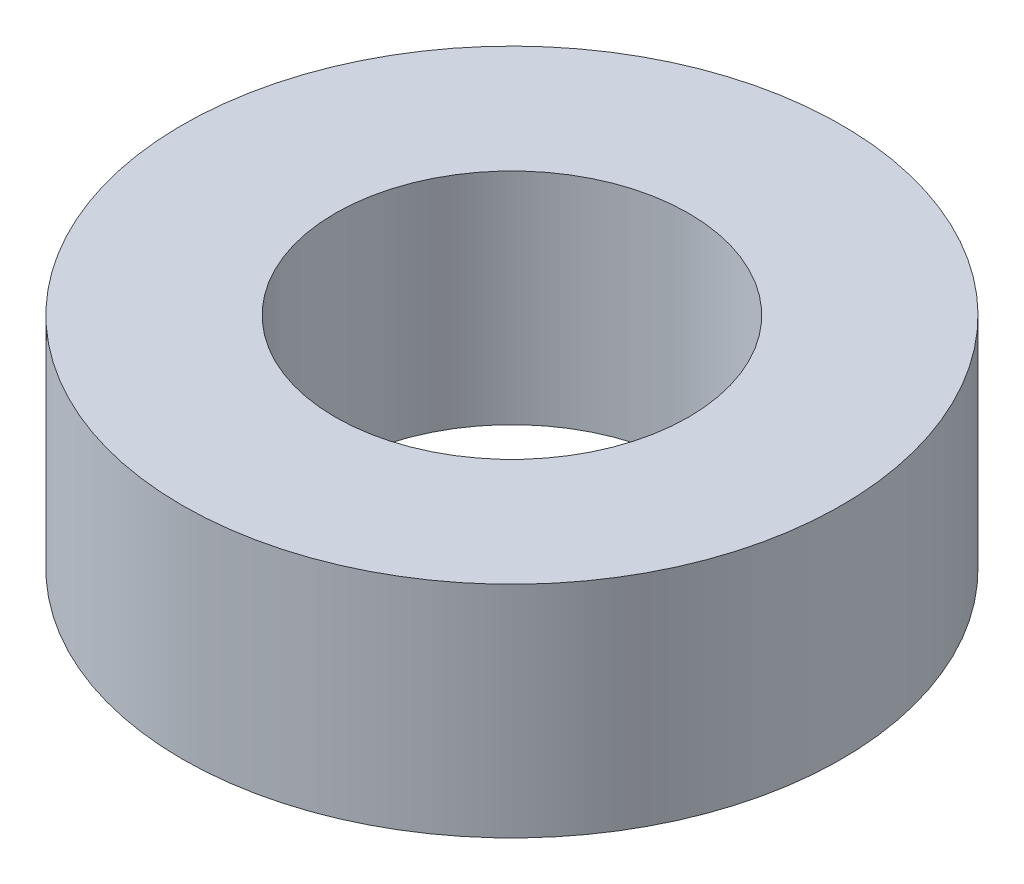
from build123d import *

# Parameters (mm, degrees)
SKETCH1_R           = 4.7625
SKETCH1_R_2         = 2.5527
BOSS_EXTRUDE1_DEPTH = 1.5875


with BuildPart() as part:
    # Sketch1 → Boss-Extrude1 (new, symmetric)
    with BuildSketch(Plane(origin=(0, 0, 0), x_dir=(1, 0, 0), z_dir=(0, 1, 0))):
        with Locations(Location((0, 0, 0), (0, 0, 270))):
            Circle(SKETCH1_R)
        with Locations(Location((0, 0, 0), (0, 0, 270))):
            Circle(SKETCH1_R_2, mode=Mode.SUBTRACT)
    extrude(amount=BOSS_EXTRUDE1_DEPTH, both=True)


solid = part.part
